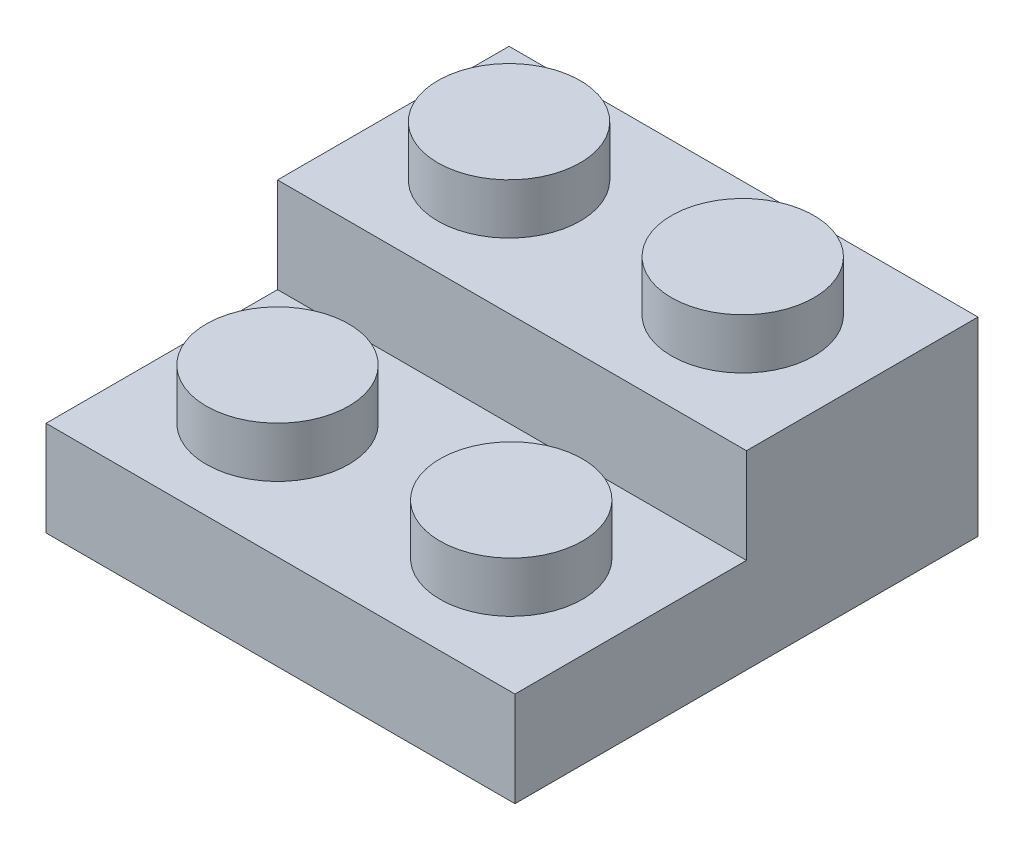
from build123d import *

# Parameters (mm, degrees)
SKETCH_1_W          = 15.8
SKETCH_1_H          = 15.600000042
EXTRUDE_2_DEPTH     = 6.4
CUT_EXTRUDE_1_DEPTH = 3.2
SKETCH_3_R          = 2.400000003
EXTRUDE_3_DEPTH     = 1.7
SKETCH_4_R          = 2.4
EXTRUDE_4_DEPTH     = 1.7
CUT_EXTRUDE_2_DEPTH = 1.8
SKETCH_6_R          = 2.5
CUT_EXTRUDE_3_DEPTH = 1.8


with BuildPart() as part:
    # Эскиз1 → Бобышка-Вытянуть2 (new body)
    with BuildSketch(Plane(origin=(0, 0, 0), x_dir=(1, 0, 0), z_dir=(0, 1, 0))):
        Rectangle(SKETCH_1_W, SKETCH_1_H)
    extrude(amount=EXTRUDE_2_DEPTH)

    # Эскиз2 → Вырез-Вытянуть1 (cut)
    with BuildSketch(Plane(origin=(0, 6.4, 0), x_dir=(1, 0, 0), z_dir=(0, 1, 0))):
        Polygon((7.9, 0), (0, 0), (-7.9, 0), (-7.9, -7.800000021), (7.9, -7.800000021), align=None)
    extrude(amount=-CUT_EXTRUDE_1_DEPTH, mode=Mode.SUBTRACT)

    # Эскиз3 → Бобышка-Вытянуть3 (add)
    with BuildSketch(Plane(origin=(0, 3.2, 0), x_dir=(1, 0, 0), z_dir=(0, 1, 0))):
        with Locations(Location((-4, -3.900000021, 0), (0, 0, 270))):
            Circle(SKETCH_3_R)
        with Locations(Location((3.874, -3.900000021, 0), (0, 0, 270))):
            Circle(SKETCH_3_R)
    extrude(amount=EXTRUDE_3_DEPTH)

    # Эскиз4 → Бобышка-Вытянуть4 (add)
    with BuildSketch(Plane(origin=(0, 6.4, 0), x_dir=(1, 0, 0), z_dir=(0, 1, 0))):
        with Locations(Location((-4, 3.900000021, 0), (0, 0, 270))):
            Circle(SKETCH_4_R)
        with Locations(Location((3.874, 3.900000021, 0), (0, 0, 270))):
            Circle(SKETCH_4_R)
    extrude(amount=EXTRUDE_4_DEPTH)

    # Эскиз5 → Вырез-Вытянуть2 (cut)
    with BuildSketch(Plane.XZ):
        with BuildLine():
            ThreePointArc((2.241714395, 5.006669145), (0, 6.400000011), (-2.241714395, 5.006669145))
            Line((-2.241714395, 5.006669145), (0, 3.900000011))
            Line((0, 3.900000011), (2.241714395, 5.006669145))
        make_face()
        with BuildLine():
            Line((0, 3.900000011), (-2.241714395, 5.006669145))
            ThreePointArc((-2.241714395, 5.006669145), (-2.5, 3.900000011), (-2.241714395, 2.793330876))
            Line((-2.241714395, 2.793330876), (0, 3.900000011))
        make_face()
        with BuildLine():
            Line((0, 3.900000011), (-2.241714395, 2.793330876))
            ThreePointArc((-2.241714395, 2.793330876), (0, 1.400000011), (2.241714395, 2.793330876))
            Line((2.241714395, 2.793330876), (0, 3.900000011))
        make_face()
        with BuildLine():
            Line((2.241714395, 5.006669145), (0, 3.900000011))
            Line((0, 3.900000011), (2.241714395, 2.793330876))
            ThreePointArc((2.241714395, 2.793330876), (2.434572446, 3.331794936), (2.5, 3.900000011))
            ThreePointArc((2.5, 3.900000011), (2.434572446, 4.468205085), (2.241714395, 5.006669145))
        make_face()
    extrude(amount=-CUT_EXTRUDE_2_DEPTH, mode=Mode.SUBTRACT)

    # Эскиз6 → Вырез-Вытянуть3 (cut)
    with BuildSketch(Plane.XZ):
        with Locations(Location((0, -3.934549789, 0), (0, 0, 270))):
            Circle(SKETCH_6_R)
    extrude(amount=-CUT_EXTRUDE_3_DEPTH, mode=Mode.SUBTRACT)


solid = part.part
